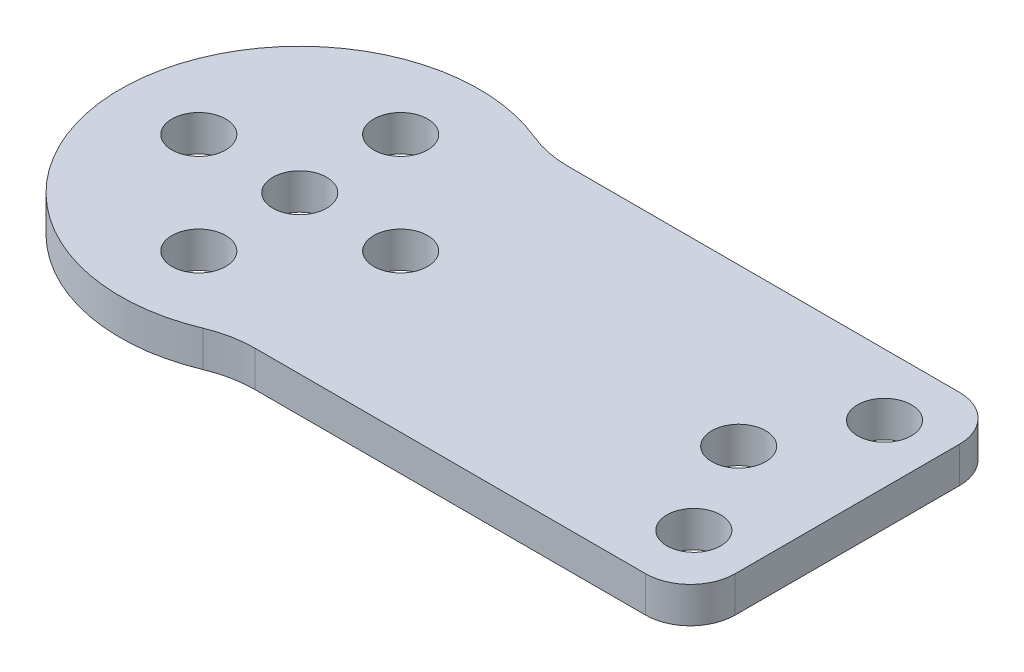
from build123d import *

# Parameters (mm, degrees)
BOSS_EXTRUDE1_DEPTH = 0.8
FILLET1_R           = 2
FILLET2_R           = 5
SKETCH2_R           = 1.2
CUT_EXTRUDE1_DEPTH  = 23.249719099
SKETCH3_R           = 1.2
CUT_EXTRUDE2_DEPTH  = 23.249719099


with BuildPart() as part:
    # Sketch1 → Boss-Extrude1 (new, symmetric)
    with BuildSketch(Plane(origin=(0, 0, 0), x_dir=(1, 0, 0), z_dir=(0, 1, 0))):
        with BuildLine():
            Line((11.716387939, 7), (-8.827016654, 7))
            ThreePointArc((-8.827016654, 7), (-20.7, 0), (-8.827016654, -7))
            Line((-8.827016654, -7), (11.716387939, -7))
            Line((11.716387939, -7), (11.716387939, 7))
        make_face()
    extrude(amount=BOSS_EXTRUDE1_DEPTH, both=True)

    # Fillet1
    fillet1_edges = [part.edges().sort_by_distance(p)[0] for p in [
        (11.716387939, 0, 7),
        (11.716387939, 0, -7),
    ]]
    fillet(fillet1_edges, radius=FILLET1_R)

    # Fillet2
    fillet2_edges = [part.edges().sort_by_distance(p)[0] for p in [
        (-8.827016654, 0, 7),
        (-8.827016654, 0, -7),
    ]]
    fillet(fillet2_edges, radius=FILLET2_R)

    # Sketch2 → Cut-Extrude1 (cut, through all)
    with BuildSketch(Plane(origin=(0, 0.8, 0), x_dir=(1, 0, 0), z_dir=(0, 1, 0))):
        with Locations(Location((-8.2, 0, 0), (0, 0, 270))):
            Circle(SKETCH2_R)
        with Locations(Location((-12.7, 4.5, 0), (0, 0, 270))):
            Circle(SKETCH2_R)
        with Locations(Location((-17.2, 0, 0), (0, 0, 270))):
            Circle(SKETCH2_R)
        with Locations(Location((-12.7, -4.5, 0), (0, 0, 270))):
            Circle(SKETCH2_R)
        with Locations(Location((-12.7, 0, 0), (0, 0, 270))):
            Circle(SKETCH2_R)
    extrude(amount=-CUT_EXTRUDE1_DEPTH, mode=Mode.SUBTRACT)

    # Sketch3 → Cut-Extrude2 (cut, through all)
    with BuildSketch(Plane(origin=(0, 0.8, 0), x_dir=(1, 0, 0), z_dir=(0, 1, 0))):
        with Locations(Location((9.121387939, 4.25, 0), (0, 0, 270))):
            Circle(SKETCH3_R)
        with Locations(Location((9.121387939, -4.25, 0), (0, 0, 270))):
            Circle(SKETCH3_R)
        with Locations(Location((6.871387939, 0, 0), (0, 0, 270))):
            Circle(SKETCH3_R)
    extrude(amount=-CUT_EXTRUDE2_DEPTH, mode=Mode.SUBTRACT)


solid = part.part
